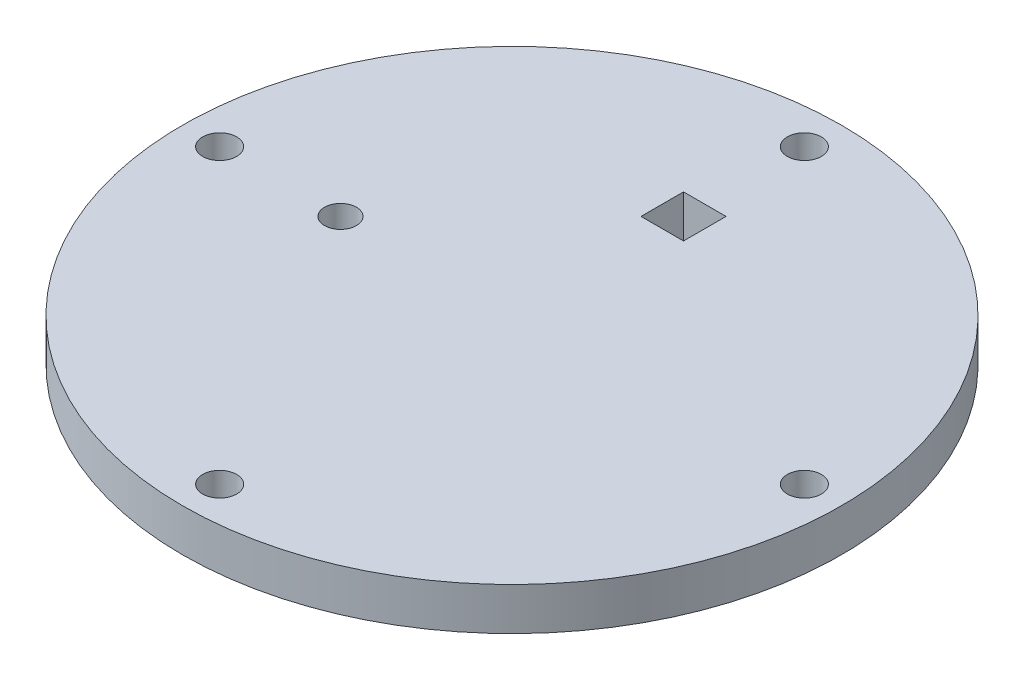
from build123d import *

# Parameters (mm, degrees)
SKETCH1_R                  = 31
BOSS_EXTRUDE1_DEPTH        = 4
F_3_2_3_2_DIAMETER_HOLE1_D = 3.2
F_3_0_3_DIAMETER_HOLE1_D   = 3
SKETCH6_W                  = 4
SKETCH6_H                  = 4
CUT_EXTRUDE2_DEPTH         = 45.022721406


with BuildPart() as part:
    # Sketch1 → Boss-Extrude1 (new body)
    with BuildSketch(Plane(origin=(0, 0, 0), x_dir=(1, 0, 0), z_dir=(0, 1, 0))):
        with Locations(Location((0, 0, 0), (0, 0, 270))):
            Circle(SKETCH1_R)
    extrude(amount=BOSS_EXTRUDE1_DEPTH)

    # Ø3.2 (3.2) Diameter Hole1 (through all)
    with Locations(Plane(origin=(0, 4, 0), x_dir=(1, 0, 0), z_dir=(0, 1, 0))):
        with Locations((-27.5, 0), (27.5, 0), (0, 27.5), (0, -27.5)):
            Hole(F_3_2_3_2_DIAMETER_HOLE1_D / 2)

    # Ø3.0 (3) Diameter Hole1 (through all)
    with Locations(Plane(origin=(0, 4, 0), x_dir=(1, 0, 0), z_dir=(0, 1, 0))):
        with Locations((-16.135, 0)):
            Hole(F_3_0_3_DIAMETER_HOLE1_D / 2)

    # Sketch6 → Cut-Extrude2 (cut, through all)
    with BuildSketch(Plane(origin=(0, 4, 0), x_dir=(1, 0, 0), z_dir=(0, 1, 0))):
        with Locations((0, 16.135)):
            Rectangle(SKETCH6_W, SKETCH6_H)
    extrude(amount=-CUT_EXTRUDE2_DEPTH, mode=Mode.SUBTRACT)


solid = part.part
